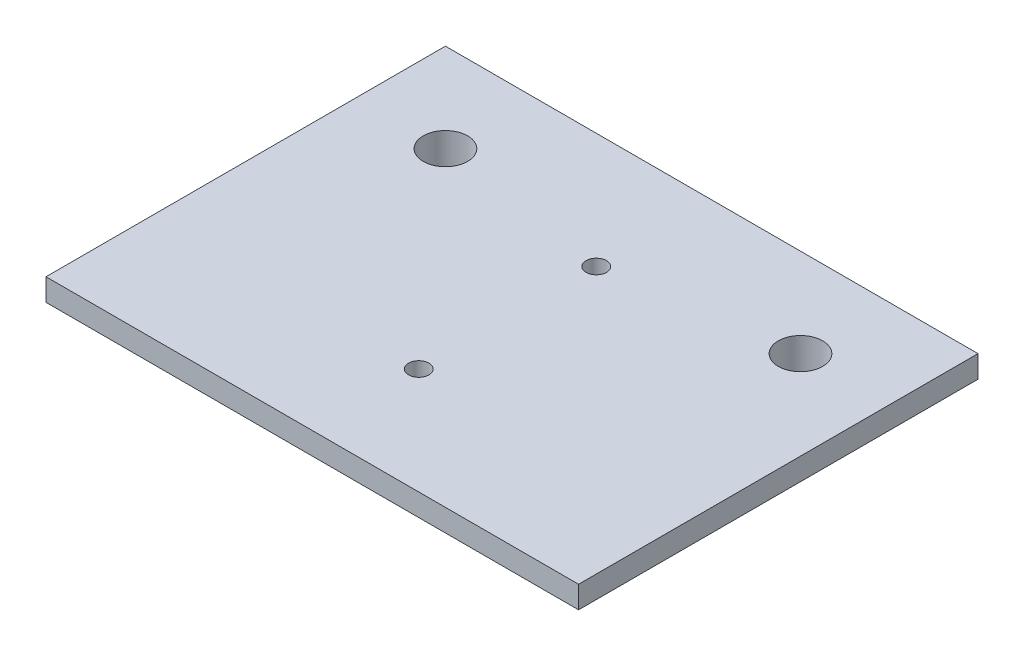
from build123d import *
from build123d.topology import SkipClean

# Parameters (mm, degrees)
SKETCH2_W           = 76.2
SKETCH2_H           = 57.15
SKETCH2_R           = 3.175
SKETCH2_R_2         = 1.4605
BOSS_EXTRUDE2_DEPTH = 3.175
BOSS_EXTRUDE6_START = 3.175
SKETCH7_W           = 12.7
SKETCH7_H           = 12.7
SKETCH7_R           = 3.175
SKETCH7_R_2         = 1.4605
BOSS_EXTRUDE6_DEPTH = 3.175


with BuildPart() as part:
    # Sketch2 → Boss-Extrude2 (new body)
    with BuildSketch(Plane(origin=(-10.658170765, 0, 0), x_dir=(1, 0, 0), z_dir=(0, 1, 0))):
        with Locations((-38.334546053, -15.875)):
            Rectangle(SKETCH2_W, SKETCH2_H)
        with Locations(Location((-63.734546053, 0, 0), (0, 0, 270))):
            Circle(SKETCH2_R, mode=Mode.SUBTRACT)
        with Locations(Location((-12.934546053, 0, 0), (0, 0, 270))):
            Circle(SKETCH2_R, mode=Mode.SUBTRACT)
        with Locations(Location((-38.334546053, -29.21, 0), (0, 0, 270))):
            Circle(SKETCH2_R_2, mode=Mode.SUBTRACT)
        with Locations(Location((-38.334546053, -3.81, 0), (0, 0, 270))):
            Circle(SKETCH2_R_2, mode=Mode.SUBTRACT)
    extrude(amount=BOSS_EXTRUDE2_DEPTH)

    # Sketch7 → Boss-Extrude6 (add)
    # profile 1 of 3: a face of its own
    with SkipClean():  # the faces are left unmerged after this step: merging them gives an invalid solid
        with BuildSketch(Plane.XZ.offset(BOSS_EXTRUDE6_START)):
            with Locations((-74.392716818, 0)):
                Rectangle(SKETCH7_W, SKETCH7_H)
            with Locations(Location((-74.392716818, 0, 0), (0, 0, 270))):
                Circle(SKETCH7_R, mode=Mode.SUBTRACT)
        # profile 2 of 3: a face of its own
        with BuildSketch(Plane.XZ.offset(BOSS_EXTRUDE6_START)):
            with Locations((-23.592716818, 0)):
                Rectangle(SKETCH7_W, SKETCH7_H)
            with Locations(Location((-23.592716818, 0, 0), (0, 0, 270))):
                Circle(SKETCH7_R, mode=Mode.SUBTRACT)
        # profile 3 of 3: a face of its own
        with BuildSketch(Plane.XZ.offset(BOSS_EXTRUDE6_START)):
            with Locations((-48.992716818, 29.21)):
                Rectangle(SKETCH7_W, SKETCH7_H)
            with Locations(Location((-48.992716818, 29.21, 0), (0, 0, 270))):
                Circle(SKETCH7_R_2, mode=Mode.SUBTRACT)
        extrude(amount=-BOSS_EXTRUDE6_DEPTH)


solid = part.part
